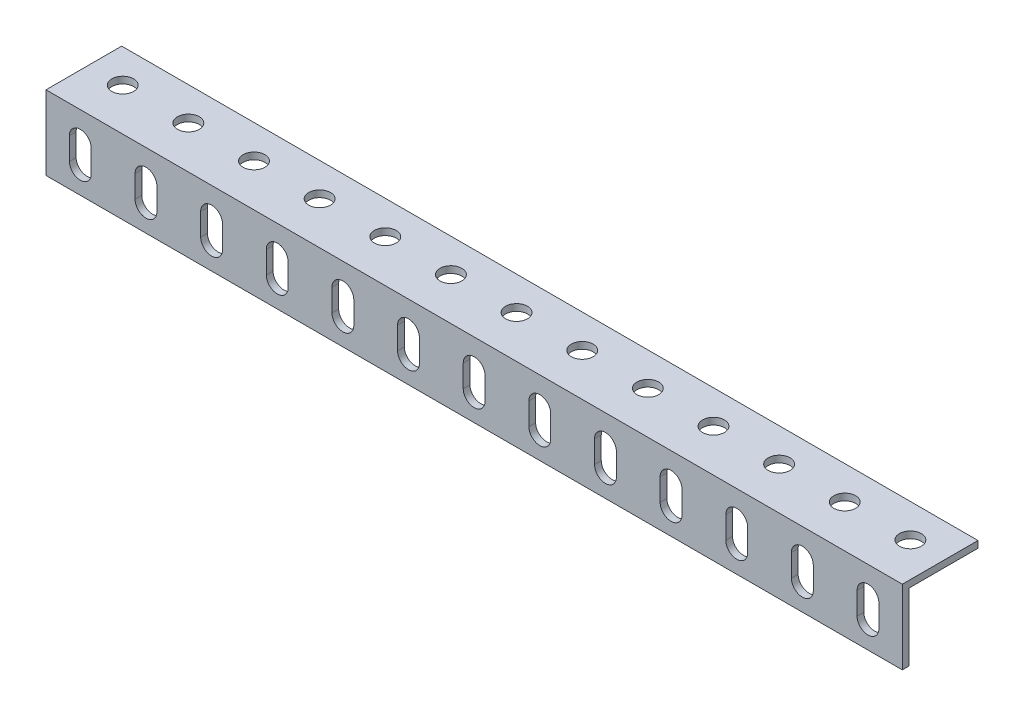
from build123d import *

# Parameters (mm, degrees)
SKETCH1_W           = 165.42
SKETCH1_H           = 14.34
BOSS_EXTRUDE1_DEPTH = 1.3
SKETCH3_W           = 165.42
SKETCH3_H           = 14.62
SKETCH3_R           = 2.11
BOSS_EXTRUDE2_DEPTH = 1.3


with BuildPart() as part:
    # Sketch1 → Boss-Extrude1 (new body)
    with BuildSketch(Plane.XY):
        with Locations((0, 0.39)):
            Rectangle(SKETCH1_W, SKETCH1_H)
        with BuildLine():
            Line((-73.97, 2.15), (-73.97, -2.15))
            ThreePointArc((-73.97, -2.15), (-76.08, -4.26), (-78.19, -2.15))
            Line((-78.19, -2.15), (-78.19, 2.15))
            ThreePointArc((-78.19, 2.15), (-76.08, 4.26), (-73.97, 2.15))
        make_face(mode=Mode.SUBTRACT)
        with BuildLine():
            Line((-65.51, 2.15), (-65.51, -2.15))
            ThreePointArc((-65.51, -2.15), (-63.4, -4.26), (-61.29, -2.15))
            Line((-61.29, -2.15), (-61.29, 2.15))
            ThreePointArc((-61.29, 2.15), (-63.4, 4.26), (-65.51, 2.15))
        make_face(mode=Mode.SUBTRACT)
        with BuildLine():
            Line((-52.83, 2.15), (-52.83, -2.15))
            ThreePointArc((-52.83, -2.15), (-50.72, -4.26), (-48.61, -2.15))
            Line((-48.61, -2.15), (-48.61, 2.15))
            ThreePointArc((-48.61, 2.15), (-50.72, 4.26), (-52.83, 2.15))
        make_face(mode=Mode.SUBTRACT)
        with BuildLine():
            Line((-40.15, 2.15), (-40.15, -2.15))
            ThreePointArc((-40.15, -2.15), (-38.04, -4.26), (-35.93, -2.15))
            Line((-35.93, -2.15), (-35.93, 2.15))
            ThreePointArc((-35.93, 2.15), (-38.04, 4.26), (-40.15, 2.15))
        make_face(mode=Mode.SUBTRACT)
        with BuildLine():
            Line((-27.47, 2.15), (-27.47, -2.15))
            ThreePointArc((-27.47, -2.15), (-25.36, -4.26), (-23.25, -2.15))
            Line((-23.25, -2.15), (-23.25, 2.15))
            ThreePointArc((-23.25, 2.15), (-25.36, 4.26), (-27.47, 2.15))
        make_face(mode=Mode.SUBTRACT)
        with BuildLine():
            Line((-14.79, 2.15), (-14.79, -2.15))
            ThreePointArc((-14.79, -2.15), (-12.68, -4.26), (-10.57, -2.15))
            Line((-10.57, -2.15), (-10.57, 2.15))
            ThreePointArc((-10.57, 2.15), (-12.68, 4.26), (-14.79, 2.15))
        make_face(mode=Mode.SUBTRACT)
        with BuildLine():
            Line((-2.11, 2.15), (-2.11, -2.15))
            ThreePointArc((-2.11, -2.15), (0, -4.26), (2.11, -2.15))
            Line((2.11, -2.15), (2.11, 2.15))
            ThreePointArc((2.11, 2.15), (0, 4.26), (-2.11, 2.15))
        make_face(mode=Mode.SUBTRACT)
        with BuildLine():
            Line((10.57, 2.15), (10.57, -2.15))
            ThreePointArc((10.57, -2.15), (12.68, -4.26), (14.79, -2.15))
            Line((14.79, -2.15), (14.79, 2.15))
            ThreePointArc((14.79, 2.15), (12.68, 4.26), (10.57, 2.15))
        make_face(mode=Mode.SUBTRACT)
        with BuildLine():
            Line((23.25, 2.15), (23.25, -2.15))
            ThreePointArc((23.25, -2.15), (25.36, -4.26), (27.47, -2.15))
            Line((27.47, -2.15), (27.47, 2.15))
            ThreePointArc((27.47, 2.15), (25.36, 4.26), (23.25, 2.15))
        make_face(mode=Mode.SUBTRACT)
        with BuildLine():
            Line((35.93, 2.15), (35.93, -2.15))
            ThreePointArc((35.93, -2.15), (38.04, -4.26), (40.15, -2.15))
            Line((40.15, -2.15), (40.15, 2.15))
            ThreePointArc((40.15, 2.15), (38.04, 4.26), (35.93, 2.15))
        make_face(mode=Mode.SUBTRACT)
        with BuildLine():
            Line((48.61, 2.15), (48.61, -2.15))
            ThreePointArc((48.61, -2.15), (50.72, -4.26), (52.83, -2.15))
            Line((52.83, -2.15), (52.83, 2.15))
            ThreePointArc((52.83, 2.15), (50.72, 4.26), (48.61, 2.15))
        make_face(mode=Mode.SUBTRACT)
        with BuildLine():
            Line((61.29, 2.15), (61.29, -2.15))
            ThreePointArc((61.29, -2.15), (63.4, -4.26), (65.51, -2.15))
            Line((65.51, -2.15), (65.51, 2.15))
            ThreePointArc((65.51, 2.15), (63.4, 4.26), (61.29, 2.15))
        make_face(mode=Mode.SUBTRACT)
        with BuildLine():
            Line((73.97, 2.15), (73.97, -2.15))
            ThreePointArc((73.97, -2.15), (76.08, -4.26), (78.19, -2.15))
            Line((78.19, -2.15), (78.19, 2.15))
            ThreePointArc((78.19, 2.15), (76.08, 4.26), (73.97, 2.15))
        make_face(mode=Mode.SUBTRACT)
    extrude(amount=-BOSS_EXTRUDE1_DEPTH)

    # Sketch3 → Boss-Extrude2 (add)
    with BuildSketch(Plane(origin=(0, 7.56, 0), x_dir=(1, 0, 0), z_dir=(0, 1, 0))):
        with Locations((0, 7.31)):
            Rectangle(SKETCH3_W, SKETCH3_H)
        with Locations(Location((-76.08, 8.19, 0), (0, 0, 270))):
            Circle(SKETCH3_R, mode=Mode.SUBTRACT)
        with Locations(Location((-63.4, 8.19, 0), (0, 0, 270))):
            Circle(SKETCH3_R, mode=Mode.SUBTRACT)
        with Locations(Location((-50.72, 8.19, 0), (0, 0, 270))):
            Circle(SKETCH3_R, mode=Mode.SUBTRACT)
        with Locations(Location((-38.04, 8.19, 0), (0, 0, 270))):
            Circle(SKETCH3_R, mode=Mode.SUBTRACT)
        with Locations(Location((-25.36, 8.19, 0), (0, 0, 270))):
            Circle(SKETCH3_R, mode=Mode.SUBTRACT)
        with Locations(Location((-12.68, 8.19, 0), (0, 0, 270))):
            Circle(SKETCH3_R, mode=Mode.SUBTRACT)
        with Locations(Location((0, 8.19, 0), (0, 0, 270))):
            Circle(SKETCH3_R, mode=Mode.SUBTRACT)
        with Locations(Location((12.68, 8.19, 0), (0, 0, 270))):
            Circle(SKETCH3_R, mode=Mode.SUBTRACT)
        with Locations(Location((25.36, 8.19, 0), (0, 0, 270))):
            Circle(SKETCH3_R, mode=Mode.SUBTRACT)
        with Locations(Location((38.04, 8.19, 0), (0, 0, 270))):
            Circle(SKETCH3_R, mode=Mode.SUBTRACT)
        with Locations(Location((50.72, 8.19, 0), (0, 0, 270))):
            Circle(SKETCH3_R, mode=Mode.SUBTRACT)
        with Locations(Location((63.4, 8.19, 0), (0, 0, 270))):
            Circle(SKETCH3_R, mode=Mode.SUBTRACT)
        with Locations(Location((76.08, 8.19, 0), (0, 0, 270))):
            Circle(SKETCH3_R, mode=Mode.SUBTRACT)
    extrude(amount=-BOSS_EXTRUDE2_DEPTH)


solid = part.part
